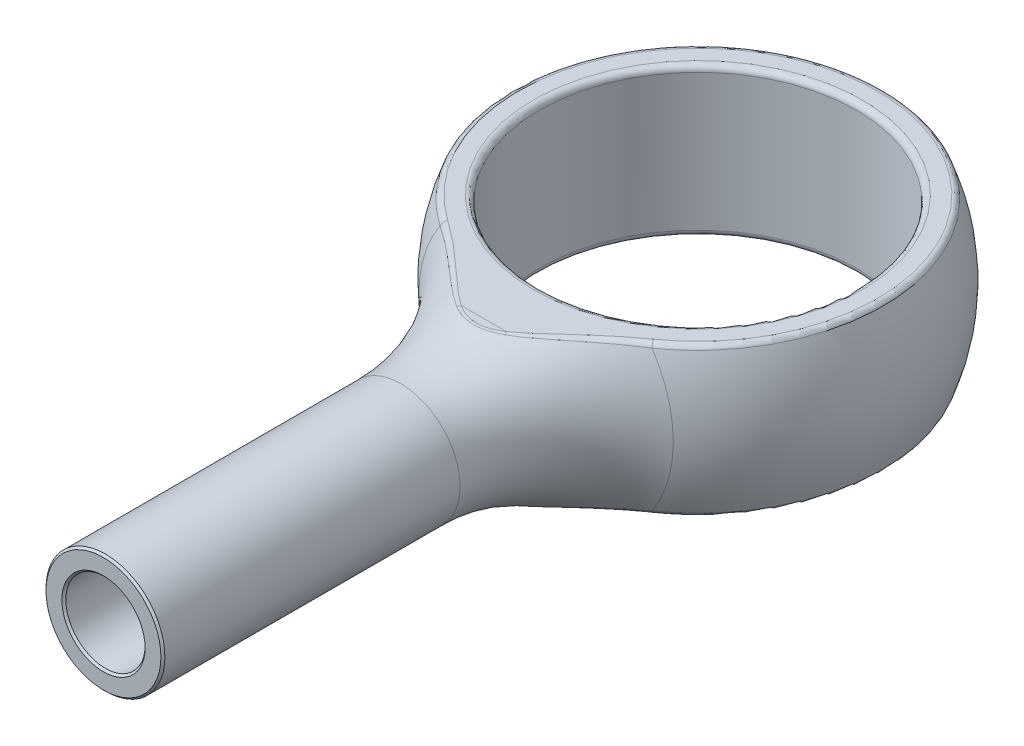
from build123d import *

# Parameters (mm, degrees)
CUT_EXTRUDE1_DEPTH      = 10
CUT_EXTRUDE1_DEPTH_BACK = 10
CUT_EXTRUDE2_DEPTH      = 10
CUT_EXTRUDE2_DEPTH_BACK = 10
SKETCH4_R               = 4
FILLET1_R               = 0.15
SKETCH5_R               = 1
CUT_EXTRUDE3_DEPTH      = 5
CHAMFER1_SIZE           = 0.05


with BuildPart() as part:
    # Sketch2 → Revolve1 (revolve)
    with BuildSketch(Plane(origin=(0, 0, 0), x_dir=(1, 0, 0), z_dir=(0, 1, 0))):
        with BuildLine():
            Line((-1.5, -15), (0, -15))
            Line((0, -15), (0, 5))
            ThreePointArc((0, 5), (-4.698967117, 1.708715315), (-3.211678832, -3.832116788))
            ThreePointArc((-3.211678832, -3.832116788), (-1.948980687, -5.476190987), (-1.5, -7.5))
            Line((-1.5, -7.5), (-1.5, -15))
        make_face()
    revolve(axis=Axis((0, 0, -5), (0, 0, 1)))

    # Sketch3 → Cut-Extrude1 (cut, two sides: drawn at the far end of the back side and taken through both)
    with BuildSketch(Plane(origin=(0, 0, 0), x_dir=(0, 0, -1), z_dir=(1, 0, 0)).offset(-CUT_EXTRUDE1_DEPTH_BACK)):
        with BuildLine():
            Line((-16.831926358, 8.772260164), (6.700748414, 8.772260164))
            Line((6.700748414, 8.772260164), (6.700748414, 1.875))
            Line((6.700748414, 1.875), (-5.405124058, 1.875))
            ThreePointArc((-5.405124058, 1.875), (-6.908653056, 2.106415246), (-8.27300624, 2.779239779))
            Line((-8.27300624, 2.779239779), (-16.831926358, 8.772260164))
        make_face()
        with BuildLine():
            Line((-8.27300624, -2.779239779), (-16.831926358, -8.772260164))
            Line((-16.831926358, -8.772260164), (6.700748414, -8.772260164))
            Line((6.700748414, -8.772260164), (6.700748414, -1.875))
            Line((6.700748414, -1.875), (-5.405124058, -1.875))
            ThreePointArc((-5.405124058, -1.875), (-6.908653056, -2.106415246), (-8.27300624, -2.779239779))
        make_face()
    extrude(amount=CUT_EXTRUDE1_DEPTH + CUT_EXTRUDE1_DEPTH_BACK, mode=Mode.SUBTRACT)

    # Sketch4 → Cut-Extrude2 (cut, two sides: drawn at the far end of the back side and taken through both)
    with BuildSketch(Plane(origin=(0, 0, 0), x_dir=(1, 0, 0), z_dir=(0, 1, 0)).offset(-CUT_EXTRUDE2_DEPTH_BACK)):
        Circle(SKETCH4_R)
    extrude(amount=CUT_EXTRUDE2_DEPTH + CUT_EXTRUDE2_DEPTH_BACK, mode=Mode.SUBTRACT)

    # Fillet1
    fillet1_edges = [part.edges().sort_by_distance(p)[0] for p in [
        (-4, 1.875, 0),
        (-4, -1.875, 0),
        (0, -1.875, -4.635124054),
        (1.61538745, -1.875, 4.60505408),
        (-1e-09, -1.880099097, 5.630878273),
        (-1.61538745, -1.875, 4.60505408),
        (0, 1.875, -4.635124054),
        (-1.61538745, 1.875, 4.60505408),
        (1e-09, 1.880099097, 5.630878273),
        (1.61538745, 1.875, 4.60505408),
    ]]
    fillet(fillet1_edges, radius=FILLET1_R)

    # Sketch5 → Cut-Extrude3 (cut)
    with BuildSketch(Plane.XY.offset(15)):
        Circle(SKETCH5_R)
    extrude(amount=-CUT_EXTRUDE3_DEPTH, mode=Mode.SUBTRACT)

    # Chamfer1
    chamfer1_edges = [part.edges().sort_by_distance(p)[0] for p in [
        (1.5, 0, 15),
        (-1, 0, 15),
    ]]
    chamfer(chamfer1_edges, length=CHAMFER1_SIZE)


solid = part.part
